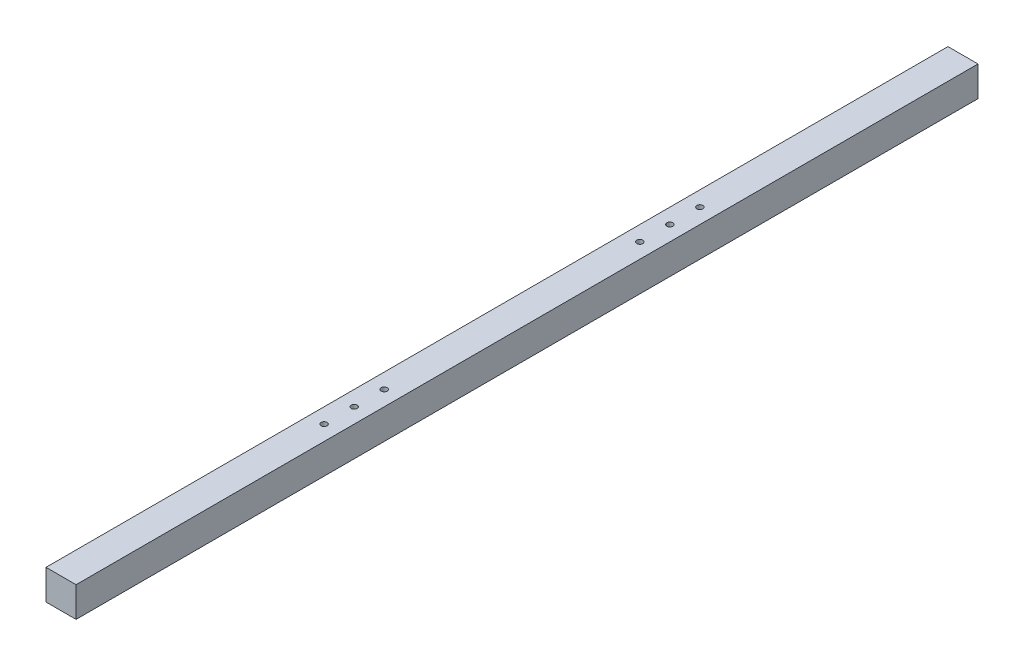
from build123d import *

# Parameters (mm, degrees)
SKETCH_1_W               = 20
SKETCH_1_H               = 20
EXTRUDE_1_DEPTH          = 600
CUT_EXTRUDE_1_DEPTH      = 601.416522091
CUT_EXTRUDE_1_DEPTH_BACK = 601.416522091
SKETCH_2_R               = 2


with BuildPart() as part:
    # 草图1 → 凸台-拉伸1 (new body)
    with BuildSketch(Plane.XY):
        Rectangle(SKETCH_1_W, SKETCH_1_H)
    extrude(amount=EXTRUDE_1_DEPTH)

    # 草图2 → 切除-拉伸1 (cut, two sides: drawn at the far end of the back side and taken through both)
    with BuildSketch(Plane(origin=(0, 10, 0), x_dir=(1, 0, 0), z_dir=(0, 1, 0)).offset(-CUT_EXTRUDE_1_DEPTH_BACK)):
        with Locations(Location((0, -195, 0), (0, 0, 270))):
            Circle(SKETCH_2_R)
        with Locations(Location((0, -175, 0), (0, 0, 270))):
            Circle(SKETCH_2_R)
        with Locations(Location((0, -215, 0), (0, 0, 270))):
            Circle(SKETCH_2_R)
        with Locations(Location((0, -385, 0), (0, 0, 90))):
            Circle(SKETCH_2_R)
        with Locations(Location((0, -405, 0), (0, 0, 90))):
            Circle(SKETCH_2_R)
        with Locations(Location((0, -425, 0), (0, 0, 90))):
            Circle(SKETCH_2_R)
    extrude(amount=CUT_EXTRUDE_1_DEPTH + CUT_EXTRUDE_1_DEPTH_BACK, mode=Mode.SUBTRACT)


solid = part.part
